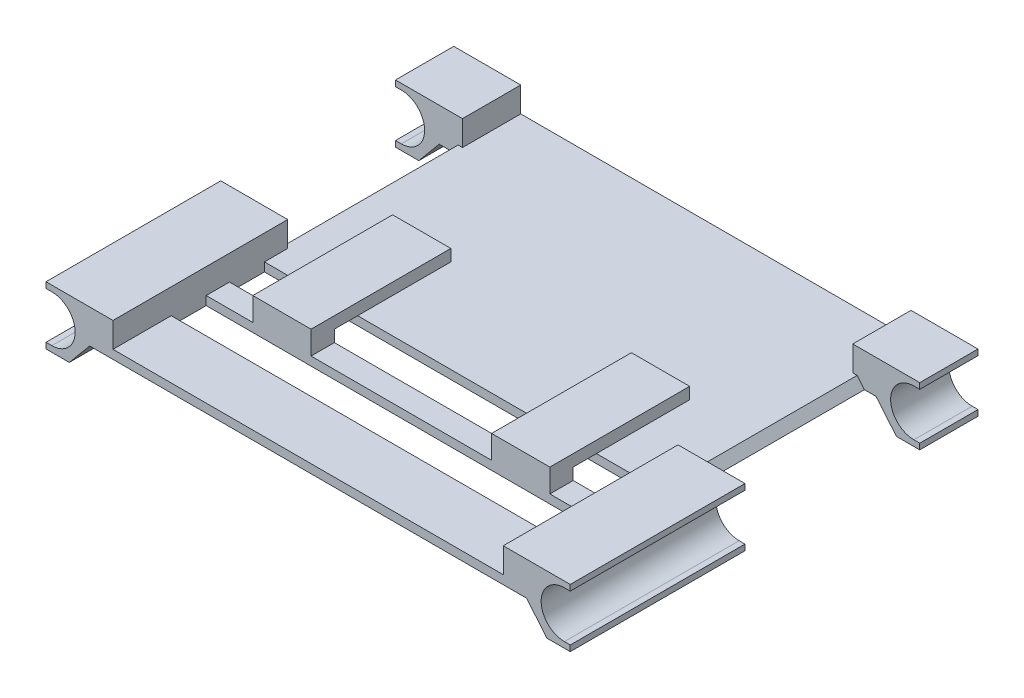
from build123d import *

# Parameters (mm, degrees)
BOSS_EXTRU_1_DEPTH      = 5
BOSS_EXTRU_2_DEPTH      = 15
BOSS_EXTRU_3_DEPTH      = 15
ESQUISSE5_W             = 2.4467389
ESQUISSE5_H             = 15
ESQUISSE5_W_2           = 2.875
ESQUISSE5_W_3           = 2.123659042
ESQUISSE5_H_2           = 5
ESQUISSE5_W_4           = 1.985062281
BOSS_EXTRU_4_DEPTH      = 2.5
ESQUISSE6_W             = 33.5
ESQUISSE6_H             = 3
ENL_V_MAT_EXTRU_1_DEPTH = 2.5
ESQUISSE8_W             = 5
ESQUISSE8_H             = 2
BOSS_EXTRU_5_DEPTH      = 1
ESQUISSE9_W             = 5
ESQUISSE9_H             = 12
BOSS_EXTRU_6_DEPTH      = 1


with BuildPart() as part:
    # Esquisse1 → Boss.-Extru.1 (new body)
    with BuildSketch(Plane.XY):
        with BuildLine():
            Line((0.5, -4.5), (0, -4.5))
            Line((0, -4.5), (0, -5))
            Line((0, -5), (0.5, -5))
            Line((0.5, -5), (2, -5))
            Line((2, -5), (3.75, -2.9))
            Line((3.75, -2.9), (41.25, -2.9))
            Line((41.25, -2.9), (43, -5))
            Line((43, -5), (44.5, -5))
            Line((44.5, -5), (45, -5))
            Line((45, -5), (45, -4.5))
            Line((45, -4.5), (44.5, -4.5))
            ThreePointArc((44.5, -4.5), (42.5, -2.5), (44.5, -0.5))
            Line((44.5, -0.5), (45, -0.5))
            Line((45, -0.5), (45, 0))
            Line((45, 0), (44.5, 0))
            Line((44.5, 0), (39.25, 0))
            Line((39.25, 0), (39.25, -0.5))
            Line((39.25, -0.5), (40.625, -2.15))
            Line((40.625, -2.15), (4.375, -2.15))
            Line((4.375, -2.15), (5.75, -0.5))
            Line((5.75, -0.5), (5.75, 0))
            Line((5.75, 0), (0, 0))
            Line((0, 0), (0, -0.5))
            Line((0, -0.5), (0.5, -0.5))
            ThreePointArc((0.5, -0.5), (2.5, -2.5), (0.5, -4.5))
        make_face()
    extrude(amount=BOSS_EXTRU_1_DEPTH)

    # Esquisse3 → Boss.-Extru.2 (add)
    with BuildSketch(Plane.XY.offset(5)):
        Polygon((40.25, -2.9), (39.625, -2.15), (5.375, -2.15), (4.75, -2.9), align=None)
    extrude(amount=BOSS_EXTRU_2_DEPTH)

    # Esquisse4 → Boss.-Extru.3 (add)
    with BuildSketch(Plane.XY.offset(20)):
        with BuildLine():
            Line((0.5, -4.5), (0, -4.5))
            Line((0, -4.5), (0, -5))
            Line((0, -5), (0.5, -5))
            Line((0.5, -5), (2, -5))
            Line((2, -5), (3.75, -2.9))
            Line((3.75, -2.9), (41.25, -2.9))
            Line((41.25, -2.9), (43, -5))
            Line((43, -5), (44.5, -5))
            Line((44.5, -5), (45, -5))
            Line((45, -5), (45, -4.5))
            Line((45, -4.5), (44.5, -4.5))
            ThreePointArc((44.5, -4.5), (42.5, -2.5), (44.5, -0.5))
            Line((44.5, -0.5), (45, -0.5))
            Line((45, -0.5), (45, 0))
            Line((45, 0), (43.697090933, 0))
            Line((43.697090933, 0), (39.25, 0))
            Line((39.25, 0), (39.25, -0.5))
            Line((39.25, -0.5), (40.625, -2.15))
            Line((40.625, -2.15), (4.375, -2.15))
            Line((4.375, -2.15), (5.75, -0.5))
            Line((5.75, -0.5), (5.75, 0))
            Line((5.75, 0), (0, 0))
            Line((0, 0), (0, -0.5))
            Line((0, -0.5), (0.5, -0.5))
            ThreePointArc((0.5, -0.5), (2.5, -2.5), (0.5, -4.5))
        make_face()
    extrude(amount=BOSS_EXTRU_3_DEPTH)

    # Esquisse5 → Boss.-Extru.4 (add)
    with BuildSketch(Plane(origin=(0, 0, 0), x_dir=(1, 0, 0), z_dir=(0, 1, 0))):
        with Locations((40.47336945, -27.5)):
            Rectangle(ESQUISSE5_W, ESQUISSE5_H)
        with Locations((4.3125, -27.5)):
            Rectangle(ESQUISSE5_W_2, ESQUISSE5_H)
        with Locations((4.688170479, -2.5)):
            Rectangle(ESQUISSE5_W_3, ESQUISSE5_H_2)
        with Locations((40.242531141, -2.5)):
            Rectangle(ESQUISSE5_W_4, ESQUISSE5_H_2)
    extrude(amount=-BOSS_EXTRU_4_DEPTH)

    # Esquisse6 → Enlèv. mat.-Extru.1 (cut)
    with BuildSketch(Plane(origin=(0, -2.15, 0), x_dir=(1, 0, 0), z_dir=(0, 1, 0))):
        with Locations((22.5, -28.5)):
            Rectangle(ESQUISSE6_W, ESQUISSE6_H)
        with Locations((22.5, -23.5)):
            Rectangle(ESQUISSE6_W, ESQUISSE6_H)
    extrude(amount=-ENL_V_MAT_EXTRU_1_DEPTH, mode=Mode.SUBTRACT)

    # Esquisse8 → Boss.-Extru.5 (add)
    with BuildSketch(Plane(origin=(0, -2.15, 0), x_dir=(1, 0, 0), z_dir=(0, 1, 0))):
        with Locations((32.75, -26)):
            Rectangle(ESQUISSE8_W, ESQUISSE8_H)
        with Locations((12.25, -26)):
            Rectangle(ESQUISSE8_W, ESQUISSE8_H)
    extrude(amount=BOSS_EXTRU_5_DEPTH)

    # Esquisse9 → Boss.-Extru.6 (add)
    with BuildSketch(Plane(origin=(0, -1.15, 0), x_dir=(1, 0, 0), z_dir=(0, 1, 0))):
        with Locations((32.75, -21)):
            Rectangle(ESQUISSE9_W, ESQUISSE9_H)
        with Locations((12.25, -21)):
            Rectangle(ESQUISSE9_W, ESQUISSE9_H)
    extrude(amount=BOSS_EXTRU_6_DEPTH)


solid = part.part
